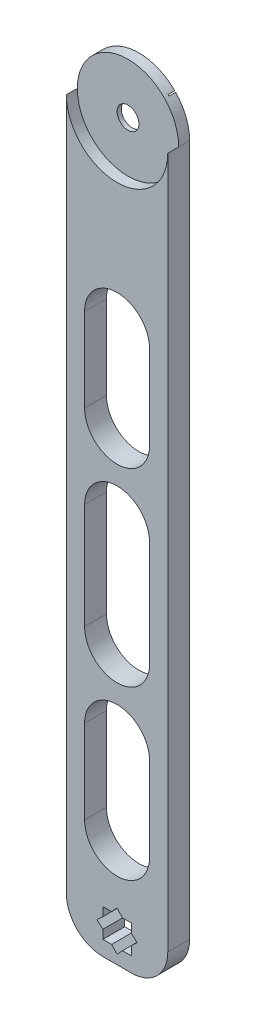
from build123d import *

# Parameters (mm, degrees)
ESQUISSE1_W             = 27.85
ESQUISSE1_H             = 200
BOSS_EXTRU_2_DEPTH      = 6
ENL_V_MAT_EXTRU_1_DEPTH = 6
ENL_V_START             = -3
ESQUISSE4_R             = 13.925
ENL_V_MAT_EXTRU_2_DEPTH = 3
ESQUISSE5_R             = 3
ENL_V_MAT_EXTRU_3_DEPTH = 3
ESQUISSE6_W             = 17.85
ESQUISSE6_H             = 23
ESQUISSE6_H_2           = 29
ENL_V_MAT_EXTRU_4_DEPTH = 10
CONG_1_R                = 10
CONG_2_R                = 10
ESQUISSE9_W             = 20.2
ESQUISSE9_H             = 40.3
ENL_V_MAT_EXTRU_7_DEPTH = 1.85
ENL_V_MAT_EXTRU_8_DEPTH = 10


with BuildPart() as part:
    # Esquisse1 → Boss.-Extru.2 (new body)
    with BuildSketch(Plane.XY):
        with Locations((1.835077519, -78.788662791)):
            Rectangle(ESQUISSE1_W, ESQUISSE1_H)
        with BuildLine():
            Line((-12.089922481, 21.211337209), (15.760077519, 21.211337209))
            ThreePointArc((15.760077519, 21.211337209), (1.835077519, 35.136337209), (-12.089922481, 21.211337209))
        make_face()
    extrude(amount=BOSS_EXTRU_2_DEPTH)

    # Esquisse3 → Enlèv. mat.-Extru.1 (cut)
    with BuildSketch(Plane.XY.offset(6)):
        with BuildLine():
            Line((4.433153731, -172.288662791), (4.433153731, -169.288662791))
            ThreePointArc((4.433153731, -169.288662791), (-1.164922481, -170.788662791), (4.433153731, -172.288662791))
        make_face()
    extrude(amount=-ENL_V_MAT_EXTRU_1_DEPTH, mode=Mode.SUBTRACT)

    # Esquisse4 → Enlèv. mat.-Extru.2 (cut)
    with BuildSketch(Plane.XY.offset(6).offset(ENL_V_START)):
        with Locations((1.835077519, 21.211337209)):
            Circle(ESQUISSE4_R)
    extrude(amount=ENL_V_MAT_EXTRU_2_DEPTH, mode=Mode.SUBTRACT)

    # Esquisse5 → Enlèv. mat.-Extru.3 (cut)
    with BuildSketch(Plane.XY.offset(3)):
        with Locations((1.835077519, 21.211337209)):
            Circle(ESQUISSE5_R)
    extrude(amount=-ENL_V_MAT_EXTRU_3_DEPTH, mode=Mode.SUBTRACT)

    # Esquisse6 → Enlèv. mat.-Extru.4 (cut)
    with BuildSketch(Plane.XY.offset(6)):
        with BuildLine():
            Line((-7.089922481, -27.788662791), (10.760077519, -27.788662791))
            ThreePointArc((10.760077519, -27.788662791), (1.835077519, -18.863662791), (-7.089922481, -27.788662791))
        make_face()
        with Locations((1.835077519, -39.288662791)):
            Rectangle(ESQUISSE6_W, ESQUISSE6_H)
        with BuildLine():
            Line((-7.089922481, -50.788662791), (10.760077519, -50.788662791))
            ThreePointArc((10.760077519, -50.788662791), (1.835077519, -59.713662791), (-7.089922481, -50.788662791))
        make_face()
        with BuildLine():
            ThreePointArc((-7.089922481, -73.788662791), (1.835077519, -64.863662791), (10.760077519, -73.788662791))
            Line((10.760077519, -73.788662791), (-7.089922481, -73.788662791))
        make_face()
        with Locations((1.835077519, -88.288662791)):
            Rectangle(ESQUISSE6_W, ESQUISSE6_H_2)
        with BuildLine():
            Line((-7.089922481, -102.788662791), (10.760077519, -102.788662791))
            ThreePointArc((10.760077519, -102.788662791), (1.835077519, -111.713662791), (-7.089922481, -102.788662791))
        make_face()
        with BuildLine():
            Line((-7.089922481, -125.788662791), (10.760077519, -125.788662791))
            ThreePointArc((10.760077519, -125.788662791), (1.835077519, -116.863662791), (-7.089922481, -125.788662791))
        make_face()
        with Locations((1.835077519, -137.288662791)):
            Rectangle(ESQUISSE6_W, ESQUISSE6_H)
        with BuildLine():
            Line((-7.089922481, -148.788662791), (10.760077519, -148.788662791))
            ThreePointArc((10.760077519, -148.788662791), (1.835077519, -157.713662791), (-7.089922481, -148.788662791))
        make_face()
    extrude(amount=-ENL_V_MAT_EXTRU_4_DEPTH, mode=Mode.SUBTRACT)

    # Congé1
    cong_1_edges = [part.edges().sort_by_distance(p)[0] for p in [
        (-12.089922481, -178.788662791, 3),
    ]]
    fillet(cong_1_edges, radius=CONG_1_R)

    # Congé2
    cong_2_edges = [part.edges().sort_by_distance(p)[0] for p in [
        (15.760077519, -178.788662791, 3),
    ]]
    fillet(cong_2_edges, radius=CONG_2_R)

    # Esquisse9 → Enlèv. mat.-Extru.7 (cut)
    with BuildSketch(Plane(origin=(0, 0, 0), x_dir=(-1, 0, 0), z_dir=(0, 0, -1))):
        with Locations((-1.830077519, 10.911337209)):
            Rectangle(ESQUISSE9_W, ESQUISSE9_H)
    extrude(amount=-ENL_V_MAT_EXTRU_7_DEPTH, mode=Mode.SUBTRACT)

    # Esquisse11 → Enlèv. mat.-Extru.8 (cut)
    # profile 1 of 7: a face of its own
    with BuildSketch(Plane.XY.offset(6)):
        Polygon((-2.060393609, -172.284133919), (-2.060393609, -169.293191663), (-3.673950582, -170.788662791), align=None)
    # profile 2 of 7: a face of its own
    with BuildSketch(Plane.XY.offset(6)):
        Polygon((0.339606391, -166.893191663), (-2.060393609, -166.893191663), (-2.060393609, -169.293191663), (-2.060393609, -172.284133919), (-2.060393609, -174.684133919), (0.339606391, -174.684133919), (3.330548647, -174.684133919), (5.730548647, -174.684133919), (5.730548647, -172.284133919), (5.730548647, -169.293191663), (5.730548647, -166.893191663), (3.330548647, -166.893191663), align=None)
        with BuildLine():
            ThreePointArc((4.433153731, -172.288662791), (-1.164922481, -170.788662791), (4.433153731, -169.288662791))
            ThreePointArc((4.433153731, -169.288662791), (4.732854998, -170.012205655), (4.835077519, -170.788662791))
            ThreePointArc((4.835077519, -170.788662791), (4.732854998, -171.565119926), (4.433153731, -172.288662791))
        make_face(mode=Mode.SUBTRACT)
    # profile 3 of 7: a face of its own
    with BuildSketch(Plane.XY.offset(6)):
        Polygon((1.835077519, -165.27963469), (0.339606391, -166.893191663), (3.330548647, -166.893191663), align=None)
    # profile 4 of 7: a face of its own
    with BuildSketch(Plane.XY.offset(6)):
        Polygon((7.34410562, -170.788662791), (5.730548647, -169.293191663), (5.730548647, -172.284133919), align=None)
    # profile 5 of 7: a face of its own
    with BuildSketch(Plane.XY.offset(6)):
        Polygon((3.330548647, -174.684133919), (0.339606391, -174.684133919), (1.835077519, -176.297690892), align=None)
    # profile 6 of 7: a face of its own
    with BuildSketch(Plane.XY.offset(6)):
        with BuildLine():
            ThreePointArc((4.835077519, -170.788662791), (4.732854998, -170.012205655), (4.433153731, -169.288662791))
            Line((4.433153731, -169.288662791), (4.433153731, -172.288662791))
            ThreePointArc((4.433153731, -172.288662791), (4.732854998, -171.565119926), (4.835077519, -170.788662791))
        make_face()
    # profile 7 of 7: a face of its own
    with BuildSketch(Plane.XY.offset(6)):
        with BuildLine():
            Line((4.433153731, -172.288662791), (4.433153731, -169.288662791))
            ThreePointArc((4.433153731, -169.288662791), (-1.164922481, -170.788662791), (4.433153731, -172.288662791))
        make_face()
    extrude(amount=-ENL_V_MAT_EXTRU_8_DEPTH, mode=Mode.SUBTRACT)


solid = part.part
